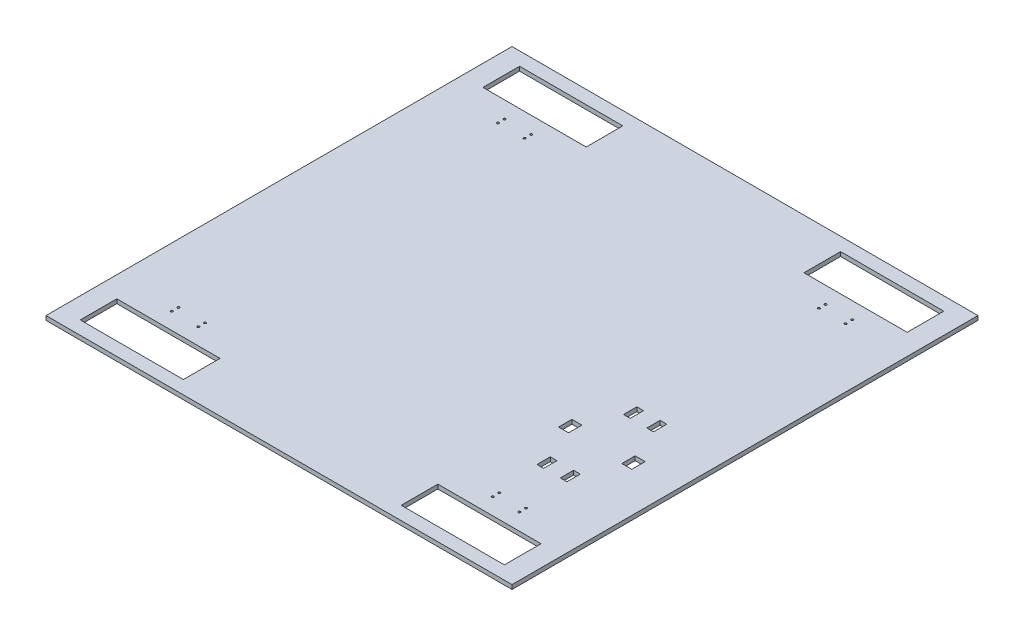
from build123d import *

# Parameters (mm, degrees)
SKETCH1_W                                  = 700
SKETCH1_H                                  = 700
BOSS_EXTRUDE1_DEPTH                        = 6.35
SKETCH2_W                                  = 155
SKETCH2_H                                  = 55
CUT_EXTRUDE2_DEPTH                         = 10
MIRROR1_AT_THE_SECOND_PLANE_COPY_1_SKETC_W = 155
MIRROR1_AT_THE_SECOND_PLANE_COPY_1_SKETC_H = 55
MIRROR1_AT_THE_SECOND_PLANE_COPY_1_DEPTH   = 10
SKETCH3_W                                  = 10
SKETCH3_H                                  = 20
SKETCH3_W_2                                = 15
CUT_EXTRUDE3_DEPTH                         = 990.96985939


with BuildPart() as part:
    # Sketch1 → Boss-Extrude1 (new body)
    with BuildSketch(Plane(origin=(0, 0, 0), x_dir=(1, 0, 0), z_dir=(0, 1, 0))):
        with Locations((350, 350)):
            Rectangle(SKETCH1_W, SKETCH1_H)
    extrude(amount=BOSS_EXTRUDE1_DEPTH)

    # Sketch2 → Cut-Extrude2 (cut)
    with BuildSketch(Plane(origin=(0, 6.35, 0), x_dir=(1, 0, 0), z_dir=(0, 1, 0))):
        with BuildLine():
            ThreePointArc((572.75, 110), (569.933273811, 111.166726189), (571.1, 108.35))
            Line((571.1, 108.35), (571.1, 110))
            Line((571.1, 110), (572.75, 110))
        make_face()
        with BuildLine():
            Line((571.1, 110), (571.1, 108.35))
            ThreePointArc((571.1, 108.35), (572.266726189, 108.833273811), (572.75, 110))
            Line((572.75, 110), (571.1, 110))
        make_face()
        with BuildLine():
            ThreePointArc((571.1, 101.65), (569.933273811, 98.833273811), (572.75, 100))
            Line((572.75, 100), (571.1, 100))
            Line((571.1, 100), (571.1, 101.65))
        make_face()
        with BuildLine():
            Line((571.1, 100), (572.75, 100))
            ThreePointArc((572.75, 100), (572.266726189, 101.166726189), (571.1, 101.65))
            Line((571.1, 101.65), (571.1, 100))
        make_face()
        with BuildLine():
            ThreePointArc((609.45, 110), (609.933273811, 108.833273811), (611.1, 108.35))
            Line((611.1, 108.35), (611.1, 110))
            Line((611.1, 110), (609.45, 110))
        make_face()
        with BuildLine():
            Line((611.1, 110), (611.1, 108.35))
            ThreePointArc((611.1, 108.35), (612.266726189, 108.833273811), (612.75, 110))
            ThreePointArc((612.75, 110), (611.1, 111.65), (609.45, 110))
            Line((609.45, 110), (611.1, 110))
        make_face()
        with BuildLine():
            ThreePointArc((611.1, 101.65), (609.933273811, 101.166726189), (609.45, 100))
            Line((609.45, 100), (611.1, 100))
            Line((611.1, 100), (611.1, 101.65))
        make_face()
        with BuildLine():
            Line((611.1, 100), (609.45, 100))
            ThreePointArc((609.45, 100), (611.1, 98.35), (612.75, 100))
            ThreePointArc((612.75, 100), (612.266726189, 101.166726189), (611.1, 101.65))
            Line((611.1, 101.65), (611.1, 100))
        make_face()
        with Locations((591.1, 47.5)):
            Rectangle(SKETCH2_W, SKETCH2_H)
    cut_extrude2 = extrude(amount=-CUT_EXTRUDE2_DEPTH, mode=Mode.SUBTRACT)

    # Mirror1: Cut-Extrude2 across plane
    add(cut_extrude2.mirror(Plane(origin=(350, 0, 0), x_dir=(0, 0, 1), z_dir=(1, 0, 0))), mode=Mode.SUBTRACT)

    # Mirror1 at the second plane: Cut-Extrude2 across plane
    add(cut_extrude2.mirror(Plane.XY.offset(-350)), mode=Mode.SUBTRACT)

    # Mirror1 at the second plane copy 1 sketc → Mirror1 at the second plane copy 1 (cut)
    with BuildSketch(Plane(origin=(700, 6.35, -700), x_dir=(-1, 0, 0), z_dir=(0, 1, 0))):
        with BuildLine():
            ThreePointArc((572.75, 110), (569.933273811, 111.166726189), (571.1, 108.35))
            Line((571.1, 108.35), (571.1, 110))
            Line((571.1, 110), (572.75, 110))
        make_face()
        with BuildLine():
            Line((571.1, 110), (571.1, 108.35))
            ThreePointArc((571.1, 108.35), (572.266726189, 108.833273811), (572.75, 110))
            Line((572.75, 110), (571.1, 110))
        make_face()
        with BuildLine():
            ThreePointArc((571.1, 101.65), (569.933273811, 98.833273811), (572.75, 100))
            Line((572.75, 100), (571.1, 100))
            Line((571.1, 100), (571.1, 101.65))
        make_face()
        with BuildLine():
            Line((571.1, 100), (572.75, 100))
            ThreePointArc((572.75, 100), (572.266726189, 101.166726189), (571.1, 101.65))
            Line((571.1, 101.65), (571.1, 100))
        make_face()
        with BuildLine():
            ThreePointArc((609.45, 110), (609.933273811, 108.833273811), (611.1, 108.35))
            Line((611.1, 108.35), (611.1, 110))
            Line((611.1, 110), (609.45, 110))
        make_face()
        with BuildLine():
            Line((611.1, 110), (611.1, 108.35))
            ThreePointArc((611.1, 108.35), (612.266726189, 108.833273811), (612.75, 110))
            ThreePointArc((612.75, 110), (611.1, 111.65), (609.45, 110))
            Line((609.45, 110), (611.1, 110))
        make_face()
        with BuildLine():
            ThreePointArc((611.1, 101.65), (609.933273811, 101.166726189), (609.45, 100))
            Line((609.45, 100), (611.1, 100))
            Line((611.1, 100), (611.1, 101.65))
        make_face()
        with BuildLine():
            Line((611.1, 100), (609.45, 100))
            ThreePointArc((609.45, 100), (611.1, 98.35), (612.75, 100))
            ThreePointArc((612.75, 100), (612.266726189, 101.166726189), (611.1, 101.65))
            Line((611.1, 101.65), (611.1, 100))
        make_face()
        with Locations((591.1, 47.5)):
            Rectangle(MIRROR1_AT_THE_SECOND_PLANE_COPY_1_SKETC_W, MIRROR1_AT_THE_SECOND_PLANE_COPY_1_SKETC_H)
    extrude(amount=-MIRROR1_AT_THE_SECOND_PLANE_COPY_1_DEPTH, mode=Mode.SUBTRACT)

    # Sketch3 → Cut-Extrude3 (cut, through all)
    with BuildSketch(Plane(origin=(0, 6.35, 0), x_dir=(1, 0, 0), z_dir=(0, 1, 0))):
        with Locations((567.5, 315)):
            Rectangle(SKETCH3_W, SKETCH3_H)
        with Locations((602.5, 315)):
            Rectangle(SKETCH3_W, SKETCH3_H)
        with Locations((537.5, 250)):
            Rectangle(SKETCH3_W_2, SKETCH3_H)
        with Locations((632.5, 250)):
            Rectangle(SKETCH3_W_2, SKETCH3_H)
        with Locations((567.5, 185)):
            Rectangle(SKETCH3_W, SKETCH3_H)
        with Locations((602.5, 185)):
            Rectangle(SKETCH3_W, SKETCH3_H)
    extrude(amount=-CUT_EXTRUDE3_DEPTH, mode=Mode.SUBTRACT)


solid = part.part
